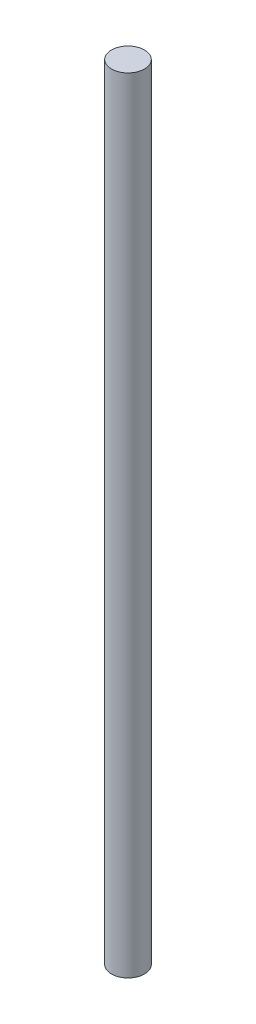
from build123d import *

# Parameters (mm, degrees)
SKETCH1_R           = 2
BOSS_EXTRUDE1_DEPTH = 95


with BuildPart() as part:
    # Sketch1 → Boss-Extrude1 (new body)
    with BuildSketch(Plane(origin=(0, 0, 0), x_dir=(1, 0, 0), z_dir=(0, 1, 0))):
        with Locations(Location((0, 0, 0), (0, 0, 270))):
            Circle(SKETCH1_R)
    extrude(amount=BOSS_EXTRUDE1_DEPTH)


solid = part.part
